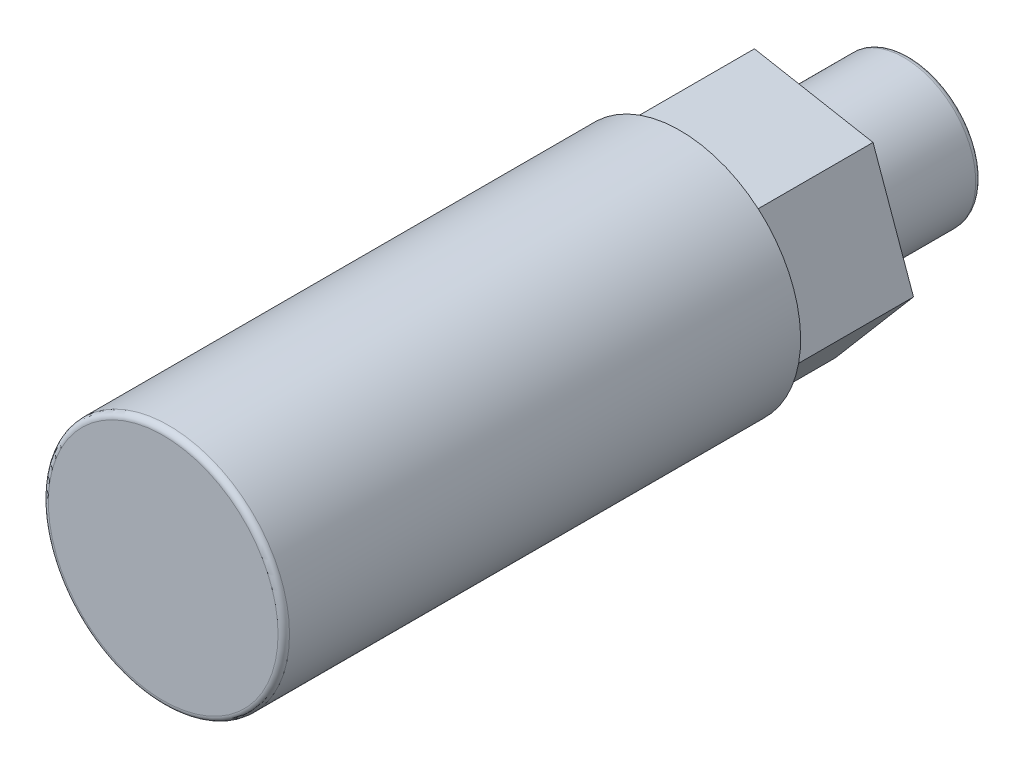
from build123d import *

# Parameters (mm, degrees)
SKETCH_1_R          = 10.5
EXTRUDE_1_DEPTH     = 45
EXTRUDE_2_DEPTH     = 10
SKETCH_3_R          = 6.25
EXTRUDE_3_DEPTH     = 10
FILLET_1_R          = 0.5
SKETCH_4_R          = 3.905073707
CUT_EXTRUDE_1_DEPTH = 60


with BuildPart() as part:
    # 草图1 → 凸台-拉伸1 (new body)
    with BuildSketch(Plane.XY):
        with Locations(Location((0, 0, 0), (0, 0, 180))):
            Circle(SKETCH_1_R)
    extrude(amount=EXTRUDE_1_DEPTH)

    # 草图2 → 凸台-拉伸2 (add)
    with BuildSketch(Plane(origin=(0, 0, 0), x_dir=(-1, 0, 0), z_dir=(0, 0, -1))):
        Polygon((6.805240256, -7.996168149), (10.327504878, 1.895426866), (3.522264622, 9.891595015), (-6.805240256, 7.996168149), (-10.327504878, -1.895426866), (-3.522264622, -9.891595015), align=None)
    extrude(amount=EXTRUDE_2_DEPTH)

    # 草图3 → 凸台-拉伸3 (add)
    with BuildSketch(Plane(origin=(0, 0, -10), x_dir=(-1, 0, 0), z_dir=(0, 0, -1))):
        Circle(SKETCH_3_R)
    extrude(amount=EXTRUDE_3_DEPTH)

    # 圆角1
    fillet_1_edges = [part.edges().sort_by_distance(p)[0] for p in [
        (6.25, 0, -20),
        (10.5, 0, 45),
    ]]
    fillet(fillet_1_edges, radius=FILLET_1_R)

    # 草图4 → 切除-拉伸1 (cut)
    with BuildSketch(Plane(origin=(0, 0, -20), x_dir=(-1, 0, 0), z_dir=(0, 0, -1))):
        Circle(SKETCH_4_R)
    extrude(amount=-CUT_EXTRUDE_1_DEPTH, mode=Mode.SUBTRACT)


solid = part.part
